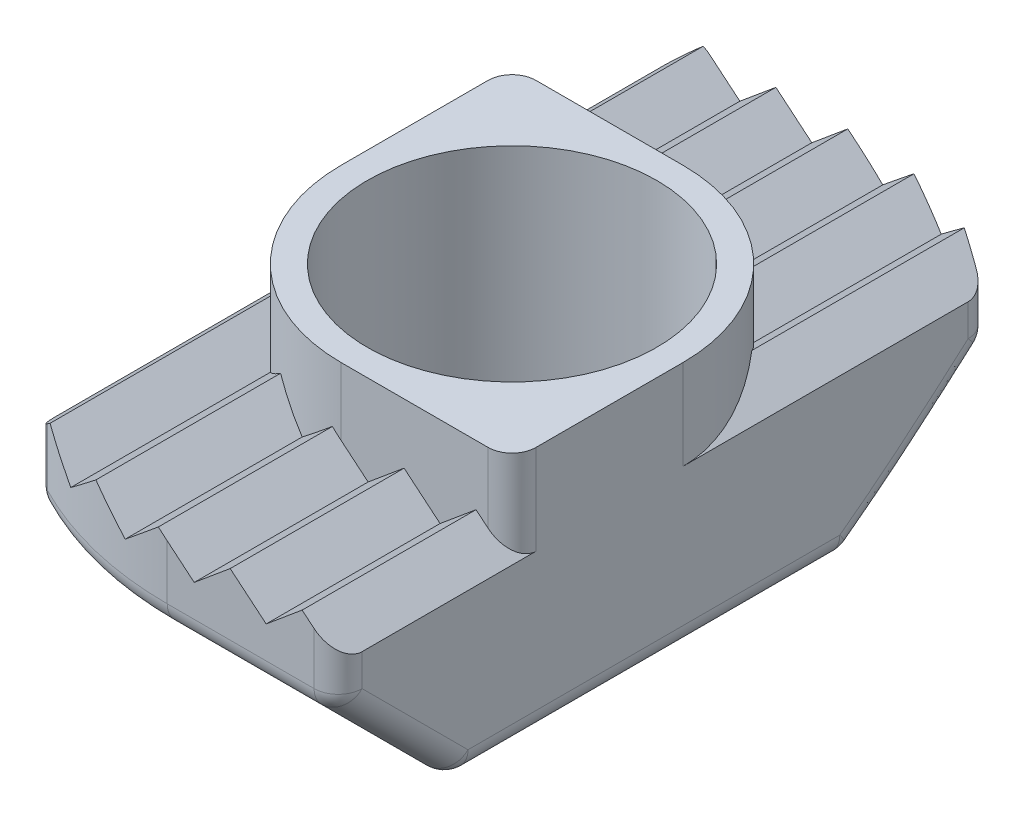
from build123d import *

# Parameters (mm, degrees)
SKETCH1_W                        = 5.7
SKETCH1_H                        = 11.5
BOSS_EXTRUDE1_DEPTH              = 1.35
BOSS_EXTRUDE2_DEPTH              = 11.5
BOSS_EXTRUDE4_DEPTH              = 1.5
CUT_EXTRUDE3_DEPTH               = 3.5
CHAMFER2_SIZE                    = 2
F_10_32_TAPPED_HOLE3_D           = 4.0386
F_10_32_TAPPED_HOLE3_DEPTH       = 12.02944
F_10_32_TAPPED_HOLE3_CBORE_D     = 4.826
F_10_32_TAPPED_HOLE3_CBORE_DEPTH = 9.652
F_10_32_TAPPED_HOLE3_TIP         = 1.213317848
FILLET2_R                        = 0.4


with BuildPart() as part:
    # Sketch1 → Boss-Extrude1 (new, symmetric)
    with BuildSketch(Plane(origin=(0, 0, 0), x_dir=(1, 0, 0), z_dir=(0, 1, 0))):
        Rectangle(SKETCH1_W, SKETCH1_H)
    extrude(amount=BOSS_EXTRUDE1_DEPTH, both=True)

    # Sketch2 → Boss-Extrude2 (add)
    with BuildSketch(Plane.XY.offset(5.75)):
        Polygon((-2.85, 1.35), (-1.95, 1.35), (-2.55, 1.85), (-2.85, 1.6), align=None)
        Polygon((-1.95, 1.35), (-0.75, 1.35), (-1.35, 1.85), align=None)
        Polygon((-0.75, 1.35), (0.45, 1.35), (-0.15, 1.85), align=None)
        Polygon((0.45, 1.35), (1.65, 1.35), (1.05, 1.85), align=None)
        Polygon((2.85, 1.35), (2.25, 1.85), (1.65, 1.35), align=None)
    extrude(amount=-BOSS_EXTRUDE2_DEPTH)

    # Sketch7 → Boss-Extrude4 (add)
    with BuildSketch(Plane.XZ.offset(-1.35)):
        with BuildLine():
            Line((0, 2.85), (2.45, 2.85))
            ThreePointArc((2.45, 2.85), (2.732842712, 2.732842712), (2.85, 2.45))
            Line((2.85, 2.45), (2.85, 0))
            ThreePointArc((2.85, 0), (2.015254326, -2.015254326), (0, -2.85))
            Line((0, -2.85), (-2.45, -2.85))
            ThreePointArc((-2.45, -2.85), (-2.732842712, -2.732842712), (-2.85, -2.45))
            Line((-2.85, -2.45), (-2.85, 0))
            ThreePointArc((-2.85, 0), (-2.015254326, 2.015254326), (0, 2.85))
        make_face()
    extrude(amount=-BOSS_EXTRUDE4_DEPTH)

    # Sketch8 → Cut-Extrude3 (cut)
    with BuildSketch(Plane.XZ.offset(1.35)):
        with BuildLine():
            Line((-2.85, 4.993996396), (-2.85, 5.75))
            Line((-2.85, 5.75), (0, 5.75))
            ThreePointArc((0, 5.75), (-1.474282999, 5.557786397), (-2.85, 4.993996396))
        make_face()
        with BuildLine():
            Line((0, -5.75), (2.85, -5.75))
            Line((2.85, -5.75), (2.85, -4.993996396))
            ThreePointArc((2.85, -4.993996396), (1.474282999, -5.557786397), (0, -5.75))
        make_face()
    extrude(amount=-CUT_EXTRUDE3_DEPTH, mode=Mode.SUBTRACT)

    # Chamfer2
    chamfer2_edges = [part.edges().sort_by_distance(p)[0] for p in [
        (1.425, -1.35, 5.75),
        (-1.474282999, -1.35, 5.557786397),
        (-1.425, -1.35, -5.75),
        (1.474282999, -1.35, -5.557786397),
    ]]
    chamfer(chamfer2_edges, length=CHAMFER2_SIZE)

    # #10-32 Tapped Hole3
    with Locations(Plane.XZ.offset(1.35)):
        with Locations((0, 0)):
            CounterBoreHole(F_10_32_TAPPED_HOLE3_D / 2, F_10_32_TAPPED_HOLE3_CBORE_D / 2, F_10_32_TAPPED_HOLE3_CBORE_DEPTH, depth=F_10_32_TAPPED_HOLE3_DEPTH)
            with Locations((0, 0, -(F_10_32_TAPPED_HOLE3_DEPTH + F_10_32_TAPPED_HOLE3_TIP / 2))):  # 118° drill point
                Cone(0, F_10_32_TAPPED_HOLE3_D / 2, F_10_32_TAPPED_HOLE3_TIP, mode=Mode.SUBTRACT)

    # Fillet2
    fillet2_edges = [part.edges().sort_by_distance(p)[0] for p in [
        (1.425, 0.65, 5.75),
        (1.425, -1.35, 3.75),
        (-1.425, 0.65, -5.75),
        (-1.425, -1.35, -3.75),
        (-1.474282999, 0.65, 5.557786397),
        (-1.568909939, -1.35, 3.406027246),
        (-2.85, -0.391617372, 3.747848312),
        (1.474282999, 0.65, -5.557786397),
        (1.568909939, -1.35, -3.406027246),
        (2.85, -0.391617372, -3.747848312),
        (2.85, 1, 5.75),
        (2.85, -0.35, 4.75),
        (-2.85, 1.125, 4.993996396),
        (-2.85, -1.35, -0.656394239),
        (-2.85, 1.125, -5.75),
        (2.85, -1.35, 0.656394239),
        (2.85, 1, -4.993996396),
    ]]
    fillet(fillet2_edges, radius=FILLET2_R)


solid = part.part
